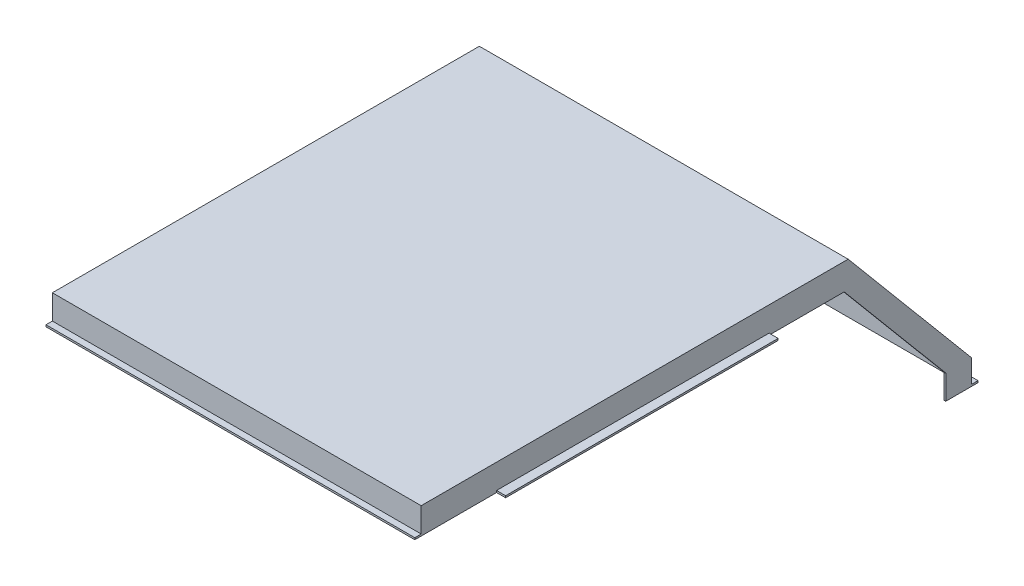
from build123d import *

# Parameters (mm, degrees)
BOSS_EXTRUDE1_DEPTH  = 203
SKETCH4_W            = 2
SKETCH4_H            = 467.122613679
BOSS_EXTRUDE4_DEPTH  = 27
SKETCH5_W            = 2
SKETCH5_H            = 209.8319636
BOSS_EXTRUDE5_DEPTH  = 20
SKETCH6_W            = 2
SKETCH6_H            = 26.5
BOSS_EXTRUDE6_DEPTH  = 26.5
SKETCH14_W           = 300
SKETCH14_H           = 2
BOSS_EXTRUDE10_DEPTH = 10
SKETCH8_W            = 50
SKETCH8_H            = 77
CUT_EXTRUDE1_DEPTH   = 189.24061
BOSS_EXTRUDE7_DEPTH  = 48
SKETCH11_W           = 2
SKETCH11_H           = 107.789220226
BOSS_EXTRUDE8_DEPTH  = 20
CUT_EXTRUDE2_DEPTH   = 2
SKETCH13_W           = 2
SKETCH13_H           = 26.5
BOSS_EXTRUDE9_DEPTH  = 15.320889


with BuildPart() as part:
    # Sketch2 → Boss-Extrude1 (new body)
    with BuildSketch(Plane(origin=(0, 0, 0), x_dir=(0, 0, -1), z_dir=(1, 0, 0))):
        Polygon((-49.538744354, 1.5), (-49.538744354, -25.5), (-58.538744354, -25.5), (-58.538744354, -23.5), (-51.538744354, -23.5), (-51.538744354, 3.5), (418.516484641, 3.5), (554.461255643, -158.512669236), (554.461255643, -183.740609705), (561.461255643, -183.740609705), (561.461255643, -185.740609705), (552.461255643, -185.740609705), (552.461255643, -159.240609705), (417.583869325, 1.5), align=None)
    boss_extrude1 = extrude(amount=BOSS_EXTRUDE1_DEPTH)

    # Sketch4 → Boss-Extrude4 (add)
    with BuildSketch(Plane(origin=(0, 1.5, 0), x_dir=(-1, 0, 0), z_dir=(0, -1, 0))):
        with Locations((-202, 184.022562486)):
            Rectangle(SKETCH4_W, SKETCH4_H)
    boss_extrude4 = extrude(amount=BOSS_EXTRUDE4_DEPTH)

    # Sketch5 → Boss-Extrude5 (add)
    with BuildSketch(Plane(origin=(0, 206.239679889, -245.786879443), x_dir=(1, 0, 0), z_dir=(0, -0.6427876096865444, 0.7660444431189738))):
        with Locations((202, -372.184652342)):
            Rectangle(SKETCH5_W, SKETCH5_H)
    boss_extrude5 = extrude(amount=BOSS_EXTRUDE5_DEPTH)

    # Sketch6 → Boss-Extrude6 (add)
    with BuildSketch(Plane.XY.offset(-552.461255643)):
        with Locations((202, -172.490609705)):
            Rectangle(SKETCH6_W, SKETCH6_H)
    boss_extrude6 = extrude(amount=BOSS_EXTRUDE6_DEPTH)

    # Sketch14 → Boss-Extrude10 (add)
    with BuildSketch(Plane(origin=(203, 0, 0), x_dir=(0, 0, -1), z_dir=(1, 0, 0))):
        with Locations((181.461255646, -24.5)):
            Rectangle(SKETCH14_W, SKETCH14_H)
    boss_extrude10 = extrude(amount=BOSS_EXTRUDE10_DEPTH)

    # Mirror3: Boss-Extrude1, Boss-Extrude4, Boss-Extrude5, Boss-Extrude6, Boss-Extrude10 across plane
    add(boss_extrude1.mirror(Plane(origin=(0, 0, 0), x_dir=(0, 0, 1), z_dir=(1, 0, 0))))
    add(boss_extrude4.mirror(Plane(origin=(0, 0, 0), x_dir=(0, 0, 1), z_dir=(1, 0, 0))))
    add(boss_extrude5.mirror(Plane(origin=(0, 0, 0), x_dir=(0, 0, 1), z_dir=(1, 0, 0))))
    add(boss_extrude6.mirror(Plane(origin=(0, 0, 0), x_dir=(0, 0, 1), z_dir=(1, 0, 0))))
    add(boss_extrude10.mirror(Plane(origin=(0, 0, 0), x_dir=(0, 0, 1), z_dir=(1, 0, 0))))

    # Sketch8 → Cut-Extrude1 (cut)
    with BuildSketch(Plane(origin=(0, 3.5, 0), x_dir=(1, 0, 0), z_dir=(0, 1, 0))):
        with Locations((-178, 522.961255643)):
            Rectangle(SKETCH8_W, SKETCH8_H)
    extrude(amount=-CUT_EXTRUDE1_DEPTH, mode=Mode.SUBTRACT)

    # Sketch10 → Boss-Extrude7 (add)
    with BuildSketch(Plane(origin=(-201, 0, 0), x_dir=(0, 0, -1), z_dir=(1, 0, 0))):
        Polygon((484.461255643, -109.315841945), (484.461255643, -78.201365408), (483.175680424, -76.669276522), (483.175680424, -107.783753059), align=None)
    extrude(amount=BOSS_EXTRUDE7_DEPTH)

    # Sketch11 → Boss-Extrude8 (add)
    with BuildSketch(Plane(origin=(0, 206.239679889, -245.786879443), x_dir=(1, 0, 0), z_dir=(0, -0.6427876096865444, 0.7660444431189738))):
        with Locations((-152, -423.206024029)):
            Rectangle(SKETCH11_W, SKETCH11_H)
    extrude(amount=BOSS_EXTRUDE8_DEPTH)

    # Sketch12 → Cut-Extrude2 (cut)
    with BuildSketch(Plane.ZY.offset(153)):
        Polygon((-483.175680424, -76.669276522), (-483.175680424, -107.783753059), (-467.854791561, -89.525028716), align=None)
    extrude(amount=-CUT_EXTRUDE2_DEPTH, mode=Mode.SUBTRACT)

    # Sketch13 → Boss-Extrude9 (add)
    with BuildSketch(Plane.XY.offset(-552.461255643)):
        with Locations((-152, -172.490609705)):
            Rectangle(SKETCH13_W, SKETCH13_H)
    extrude(amount=BOSS_EXTRUDE9_DEPTH)


solid = part.part
